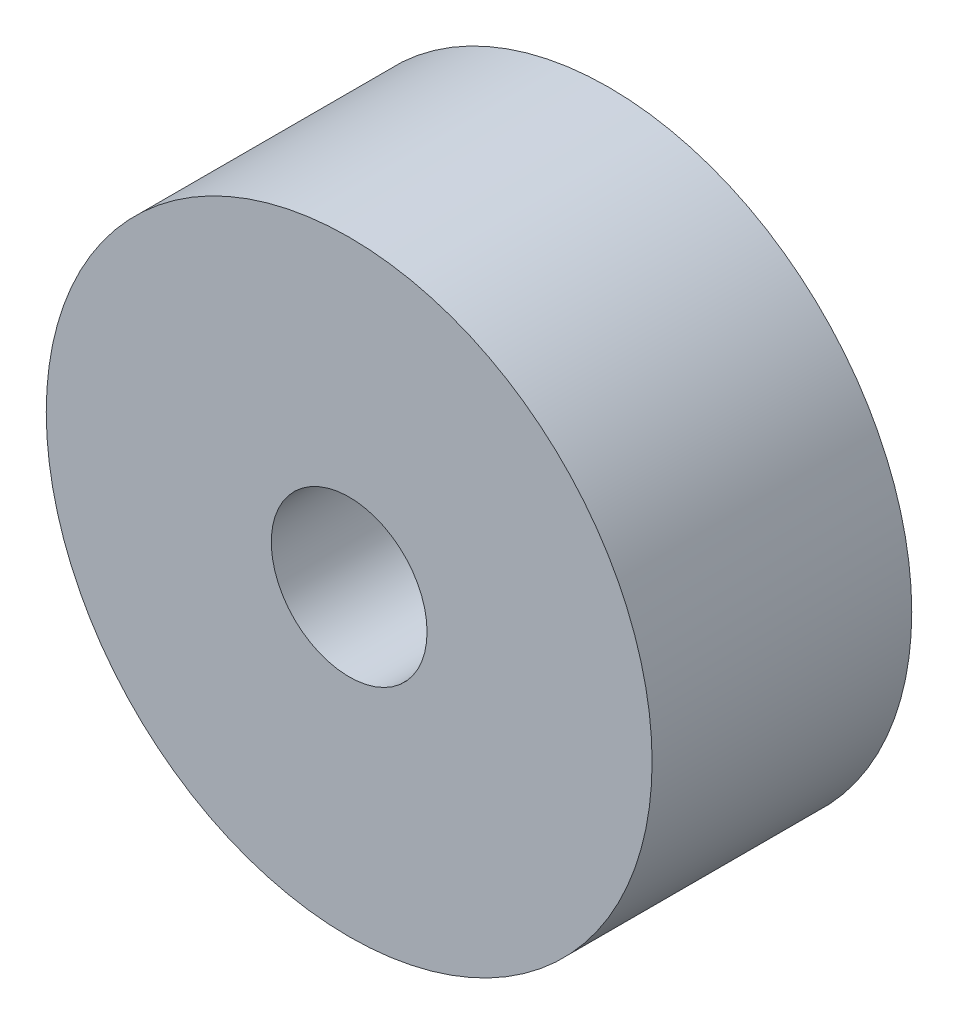
from build123d import *

# Parameters (mm, degrees)
SKETCH1_R           = 350
SKETCH1_R_2         = 90
BOSS_EXTRUDE1_DEPTH = 300
SHELL1_T            = 5


with BuildPart() as part:
    # Sketch1 → Boss-Extrude1 (new body)
    with BuildSketch(Plane.XY):
        Circle(SKETCH1_R)
        Circle(SKETCH1_R_2, mode=Mode.SUBTRACT)
    extrude(amount=BOSS_EXTRUDE1_DEPTH)

    # Shell1 (no face opened: a closed hollow body)
    add(offset(amount=-SHELL1_T, mode=Mode.PRIVATE), mode=Mode.SUBTRACT)


solid = part.part
